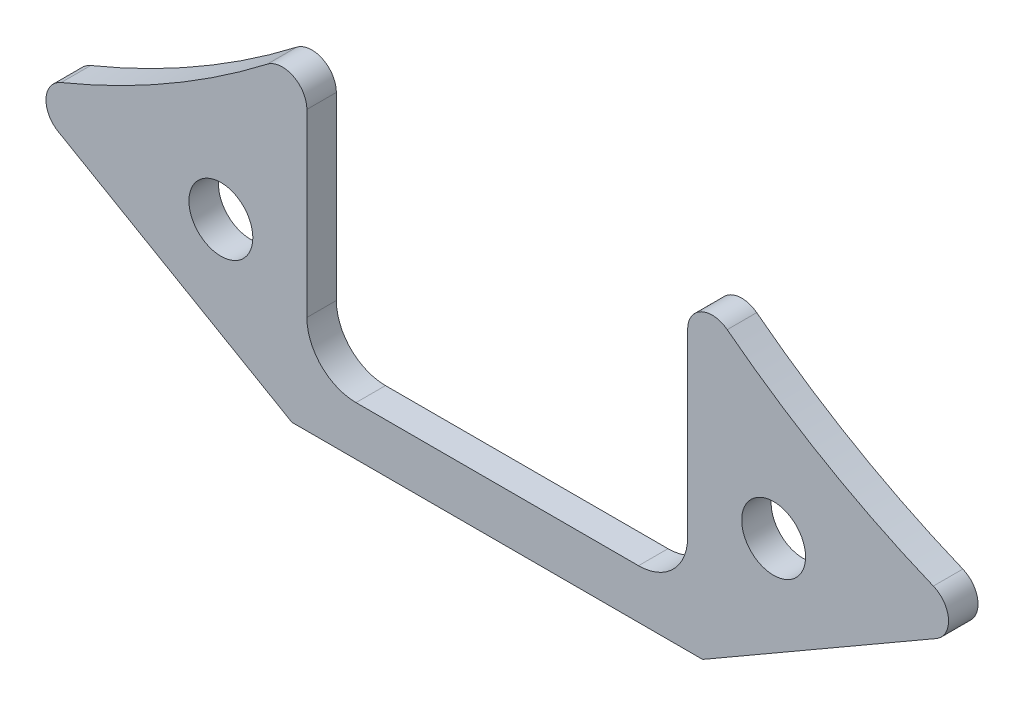
from build123d import *

# Parameters (mm, degrees)
SKETCH_2_R                       = 28.3
EXTRUDE_1_DEPTH                  = 1.2
CUT_EXTRUDE_1_DEPTH              = 41.04022977
FILLET_1_R                       = 2
FILLET_2_R                       = 0.2
PATTERN_CIRCULAR_2_COUNT         = 6
FILLET_1_OF_PATTERN_CIRCULAR_2_R = 2
FILLET_2_OF_PATTERN_CIRCULAR_2_R = 0.2
SKETCH_4_R                       = 1.25
SKETCH_4_R_2                     = 1.5
CUT_EXTRUDE_2_DEPTH              = 40.283043416
CUT_EXTRUDE_START                = -1.2
CUT_EXTRUDE_4_DEPTH              = 1.2
SKETCH_7_W                       = 2.25
SKETCH_7_H                       = 2.05
EXTRUDE_2_DEPTH                  = 1.2
SKETCH_8_R                       = 1.3
CUT_EXTRUDE_6_DEPTH              = 1.2
CUT_EXTRUDE_7_DEPTH              = 1.2
FILLET_4_R                       = 1


with BuildPart() as part:
    # ｽｹｯﾁ2 → ﾎﾞｽ - 押し出し1 (new body)
    with BuildSketch(Plane.XY):
        Circle(SKETCH_2_R)
    extrude(amount=EXTRUDE_1_DEPTH)

    # ｽｹｯﾁ3 → ｶｯﾄ - 押し出し1 (cut, through all)
    with BuildSketch(Plane.XY.offset(1.2)):
        Polygon((-7.75, 30.775), (7.75, 30.775), (7.75, 24.3), (10, 24.3), (10, 22.25), (7.75, 22.25), (7.75, 15.775), (-7.75, 15.775), (-7.75, 22.25), (-10, 22.25), (-10, 24.3), (-7.75, 24.3), align=None)
    cut_extrude_1 = extrude(amount=-CUT_EXTRUDE_1_DEPTH, mode=Mode.SUBTRACT)

    # ﾌｨﾚｯﾄ1
    fillet_1_edges = [part.edges().sort_by_distance(p)[0] for p in [
        (7.75, 15.775, 0.6),
        (-7.75, 15.775, 0.6),
    ]]
    fillet(fillet_1_edges, radius=FILLET_1_R)

    # ﾌｨﾚｯﾄ2
    fillet_2_edges = [part.edges().sort_by_distance(p)[0] for p in [
        (-10, 22.25, 0.6),
        (-10, 24.3, 0.6),
        (10, 24.3, 0.6),
        (10, 22.25, 0.6),
    ]]
    fillet(fillet_2_edges, radius=FILLET_2_R)

    # 円形ﾊﾟﾀｰﾝ2: ｶｯﾄ - 押し出し1 ×6 about axis
    pattern_circular_2_axis = Axis((0, 0, 0), (0, 0, 1))
    for i in range(1, PATTERN_CIRCULAR_2_COUNT):
        add(cut_extrude_1.rotate(pattern_circular_2_axis, i * 360 / PATTERN_CIRCULAR_2_COUNT), mode=Mode.SUBTRACT)

    # ﾌｨﾚｯﾄ1 of 円形ﾊﾟﾀｰﾝ2
    fillet_1_of_pattern_circular_2_edges = [part.edges().sort_by_distance(p)[0] for p in [
        (-9.786550745, 14.599196879, 0.6),
        (-17.536550745, 1.175803121, 0.6),
        (-17.536550745, -1.175803121, 0.6),
        (-9.786550745, -14.599196879, 0.6),
        (-7.75, -15.775, 0.6),
        (7.75, -15.775, 0.6),
        (9.786550745, -14.599196879, 0.6),
        (17.536550745, -1.175803121, 0.6),
        (17.536550745, 1.175803121, 0.6),
        (9.786550745, 14.599196879, 0.6),
    ]]
    fillet(fillet_1_of_pattern_circular_2_edges, radius=FILLET_1_OF_PATTERN_CIRCULAR_2_R)

    # ﾌｨﾚｯﾄ2 of 円形ﾊﾟﾀｰﾝ2
    fillet_2_of_pattern_circular_2_edges = [part.edges().sort_by_distance(p)[0] for p in [
        (-24.269065234, 2.464745962, 0.6),
        (-26.044417312, 3.489745962, 0.6),
        (-16.044417312, 20.810254038, 0.6),
        (-14.269065234, 19.785254038, 0.6),
        (-14.269065234, -19.785254038, 0.6),
        (-16.044417312, -20.810254038, 0.6),
        (-26.044417312, -3.489745962, 0.6),
        (-24.269065234, -2.464745962, 0.6),
        (10, -22.25, 0.6),
        (10, -24.3, 0.6),
        (-10, -24.3, 0.6),
        (-10, -22.25, 0.6),
        (24.269065234, -2.464745962, 0.6),
        (26.044417312, -3.489745962, 0.6),
        (16.044417312, -20.810254038, 0.6),
        (14.269065234, -19.785254038, 0.6),
        (14.269065234, 19.785254038, 0.6),
        (16.044417312, 20.810254038, 0.6),
        (26.044417312, 3.489745962, 0.6),
        (24.269065234, 2.464745962, 0.6),
    ]]
    fillet(fillet_2_of_pattern_circular_2_edges, radius=FILLET_2_OF_PATTERN_CIRCULAR_2_R)

    # ｽｹｯﾁ4 → ｶｯﾄ - 押し出し2 (cut, through all)
    with BuildSketch(Plane.XY.offset(1.2)):
        with Locations((11.25, -19.485571585)):
            Circle(SKETCH_4_R)
        with Locations((11.25, -58.456714755)):
            Circle(SKETCH_4_R)
        with Locations((-22.5, -77.942286341)):
            Circle(SKETCH_4_R)
        with Locations((-56.25, -58.456714755)):
            Circle(SKETCH_4_R)
        with Locations((-56.25, -19.485571585)):
            Circle(SKETCH_4_R)
        with Locations((-22.5, 0)):
            Circle(SKETCH_4_R)
        with Locations((5.5, -9.526279442)):
            Circle(SKETCH_4_R_2)
        with Locations((-11, 0)):
            Circle(SKETCH_4_R_2)
        with Locations((5.5, 9.526279442)):
            Circle(SKETCH_4_R_2)
    extrude(amount=-CUT_EXTRUDE_2_DEPTH, mode=Mode.SUBTRACT)

    # ｽｹｯﾁ5 → ｶｯﾄ - 押し出し4 (cut)
    with BuildSketch(Plane.XY.offset(1.2).offset(CUT_EXTRUDE_START)):
        with BuildLine():
            Line((-19.69660633, 20.320770139), (-8.358999874, 13.775))
            Line((-8.358999874, 13.775), (8.358999874, 13.775))
            Line((8.358999874, 13.775), (19.69660633, 20.320770139))
            ThreePointArc((19.69660633, 20.320770139), (0, -28.3), (-19.69660633, 20.320770139))
        make_face()
    extrude(amount=CUT_EXTRUDE_4_DEPTH, mode=Mode.SUBTRACT)

    # ｽｹｯﾁ7 → ﾎﾞｽ - 押し出し2 (add)
    with BuildSketch(Plane.XY.offset(1.2)):
        Polygon((-17.169417312, 18.861696879), (-16.044417312, 20.810254038), (-14.269065234, 19.785254038), (-15.394065234, 17.836696879), align=None)
        Polygon((17.169417312, 18.861696879), (15.394065234, 17.836696879), (14.269065234, 19.785254038), (16.044417312, 20.810254038), align=None)
        with Locations((-8.875, 23.275)):
            Rectangle(SKETCH_7_W, SKETCH_7_H)
        with Locations((8.875, 23.275)):
            Rectangle(SKETCH_7_W, SKETCH_7_H)
    extrude(amount=-EXTRUDE_2_DEPTH)

    # ｽｹｯﾁ8 → ｶｯﾄ - 押し出し6 (cut)
    with BuildSketch(Plane.XY.offset(1.2)):
        with Locations((11.25, 19.485571585)):
            Circle(SKETCH_8_R)
        with Locations((-11.25, 19.485571585)):
            Circle(SKETCH_8_R)
    extrude(amount=-CUT_EXTRUDE_6_DEPTH, mode=Mode.SUBTRACT)

    # ｽｹｯﾁ9 → ｶｯﾄ - 押し出し7 (cut)
    with BuildSketch(Plane.XY.offset(1.2)):
        with BuildLine():
            ThreePointArc((0, 73.021527127), (68.160815364, 54.81940806), (0, 36.617288992))
            ThreePointArc((0, 36.617288992), (-68.160815364, 54.81940806), (0, 73.021527127))
        make_face()
    extrude(amount=-CUT_EXTRUDE_7_DEPTH, mode=Mode.SUBTRACT)

    # ﾌｨﾚｯﾄ4
    fillet_4_edges = [part.edges().sort_by_distance(p)[0] for p in [
        (19.69660633, 20.320770139, 0.6),
        (-19.69660633, 20.320770139, 0.6),
        (-7.75, 27.21814652, 0.6),
        (7.75, 27.21814652, 0.6),
    ]]
    fillet(fillet_4_edges, radius=FILLET_4_R)


solid = part.part
